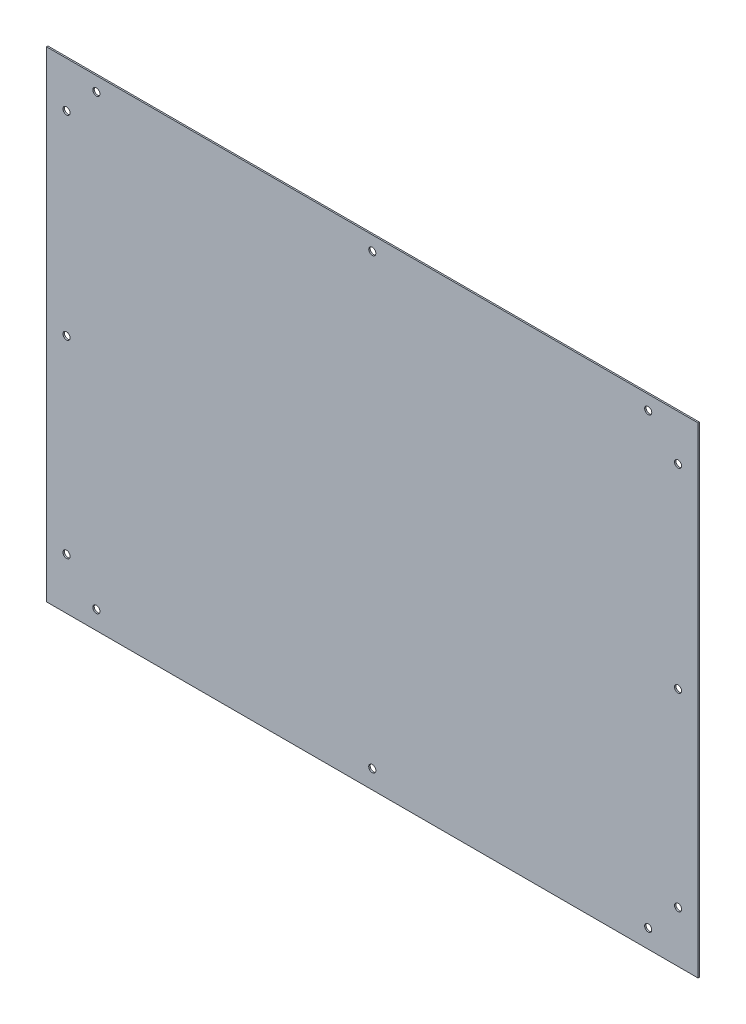
from build123d import *

# Parameters (mm, degrees)
SKETCH1_W           = 458
SKETCH1_H           = 338
BOSS_EXTRUDE1_DEPTH = 1
SKETCH2_R           = 2.5
CUT_EXTRUDE1_DEPTH  = 285.610259829


with BuildPart() as part:
    # Sketch1 → Boss-Extrude1 (new body)
    with BuildSketch(Plane.XY):
        Rectangle(SKETCH1_W, SKETCH1_H)
    extrude(amount=BOSS_EXTRUDE1_DEPTH)

    # Sketch2 → Cut-Extrude1 (cut, through all)
    with BuildSketch(Plane.XY.offset(1)):
        with Locations((-194, 159)):
            Circle(SKETCH2_R)
        with Locations((-194.002577337, -156)):
            Circle(SKETCH2_R)
        with Locations((193.997422663, -156)):
            Circle(SKETCH2_R)
        with Locations((194, 159)):
            Circle(SKETCH2_R)
        with Locations((-215, 0)):
            Circle(SKETCH2_R)
        with Locations((-215, -133)):
            Circle(SKETCH2_R)
        with Locations((-215, 137)):
            Circle(SKETCH2_R)
        with Locations((215, 0)):
            Circle(SKETCH2_R)
        with Locations((215, -133)):
            Circle(SKETCH2_R)
        with Locations((215, 137)):
            Circle(SKETCH2_R)
        with Locations((0, 159)):
            Circle(SKETCH2_R)
        with Locations((-0.002577337, -156)):
            Circle(SKETCH2_R)
    extrude(amount=-CUT_EXTRUDE1_DEPTH, mode=Mode.SUBTRACT)


solid = part.part
